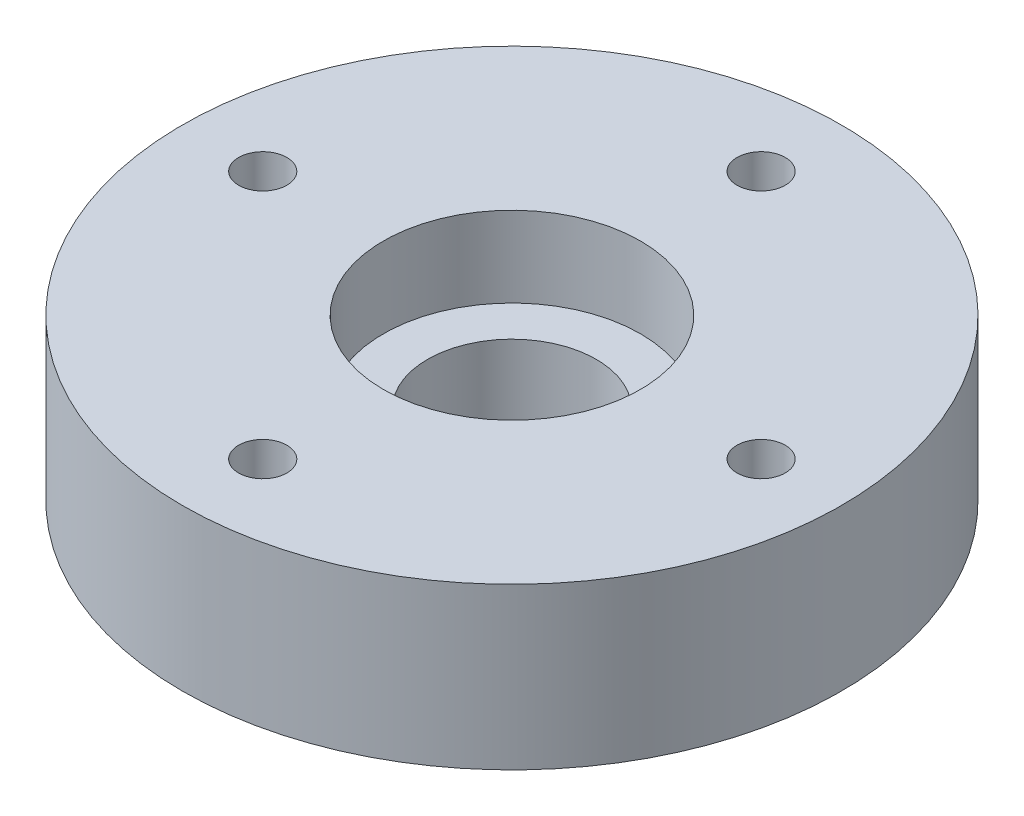
from build123d import *

# Parameters (mm, degrees)
SKETCH1_R           = 20.5
SKETCH1_R_2         = 5.25
BOSS_EXTRUDE1_DEPTH = 10
SKETCH2_R           = 8
CUT_EXTRUDE1_DEPTH  = 5
SKETCH5_R           = 1.5
CUT_EXTRUDE2_DEPTH  = 10


with BuildPart() as part:
    # Sketch1 → Boss-Extrude1 (new body)
    with BuildSketch(Plane(origin=(0, 0, 0), x_dir=(1, 0, 0), z_dir=(0, 1, 0))):
        with Locations(Location((0, 0, 0), (0, 0, 270))):
            Circle(SKETCH1_R)
        with Locations(Location((0, 0, 0), (0, 0, 270))):
            Circle(SKETCH1_R_2, mode=Mode.SUBTRACT)
    extrude(amount=BOSS_EXTRUDE1_DEPTH)

    # Sketch2 → Cut-Extrude1 (cut)
    with BuildSketch(Plane(origin=(0, 10, 0), x_dir=(1, 0, 0), z_dir=(0, 1, 0))):
        with Locations(Location((0, 0, 0), (0, 0, 270))):
            Circle(SKETCH2_R)
    extrude(amount=-CUT_EXTRUDE1_DEPTH, mode=Mode.SUBTRACT)

    # Sketch5 → Cut-Extrude2 (cut)
    with BuildSketch(Plane(origin=(0, 10, 0), x_dir=(1, 0, 0), z_dir=(0, 1, 0))):
        with Locations(Location((0, 15.5, 0), (0, 0, 270))):
            Circle(SKETCH5_R)
        with Locations(Location((15.5, 0, 0), (0, 0, 270))):
            Circle(SKETCH5_R)
        with Locations(Location((0, -15.5, 0), (0, 0, 270))):
            Circle(SKETCH5_R)
        with Locations(Location((-15.5, 0, 0), (0, 0, 270))):
            Circle(SKETCH5_R)
    extrude(amount=-CUT_EXTRUDE2_DEPTH, mode=Mode.SUBTRACT)


solid = part.part
